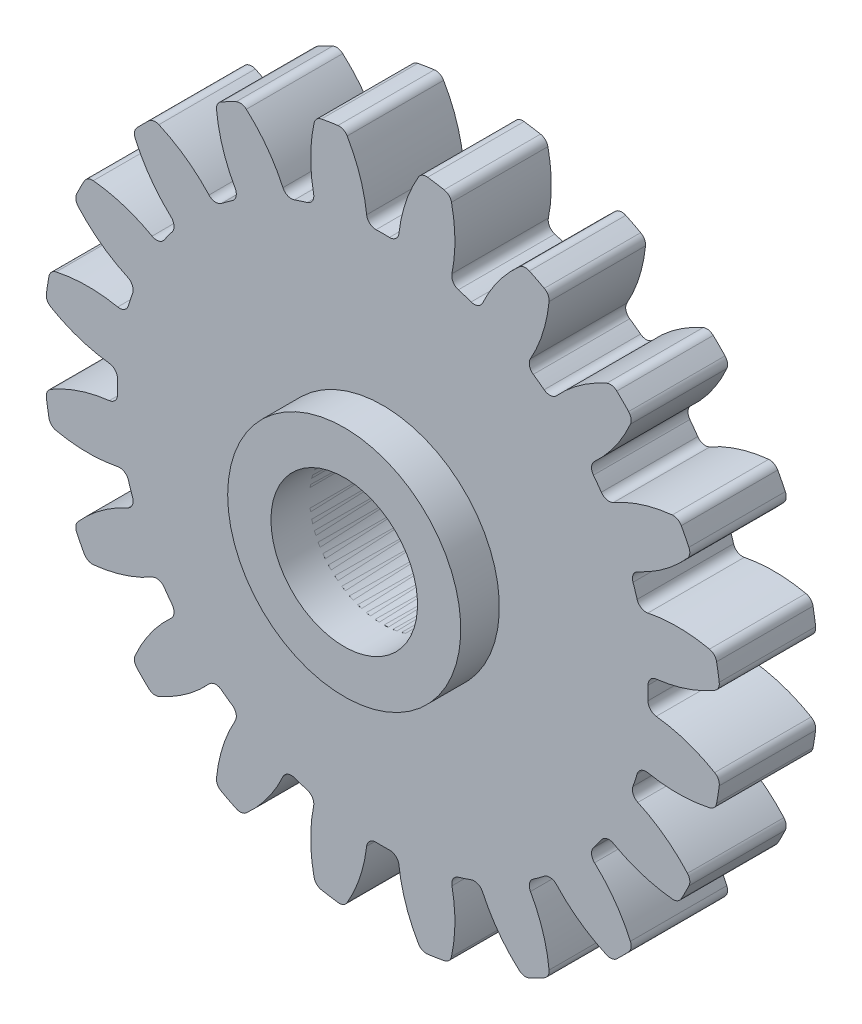
from build123d import *

# Parameters (mm, degrees)
SKETCH1_R                = 17.6
BOSS_EXTRUDE1_DEPTH      = 2.5
CUT_EXTRUDE1_DEPTH       = 26.387398449
FILLET1_R                = 0.48
CIRPATTERN1_COUNT        = 20
FILLET1_OF_CIRPATTERN1_R = 0.48
SKETCH23_R               = 3.25
CUT_EXTRUDE9_DEPTH       = 0.7
SKETCH24_R               = 4
CUT_EXTRUDE10_DEPTH      = 10
SKETCH25_R               = 4.603821227
BOSS_EXTRUDE2_DEPTH      = 5
SKETCH26_R               = 3.8
CUT_EXTRUDE11_DEPTH      = 10
BOSS_EXTRUDE3_DEPTH      = 2
BOSS_EXTRUDE3_DEPTH_BACK = 7
SKETCH27_R               = 6.044309444
SKETCH27_R_2             = 3.8


with BuildPart() as part:
    # Sketch1 → Boss-Extrude1 (new, symmetric)
    with BuildSketch(Plane.XY):
        Circle(SKETCH1_R)
    extrude(amount=BOSS_EXTRUDE1_DEPTH, both=True)

    # Sketch3 → Cut-Extrude1 (cut, symmetric)
    with BuildSketch(Plane.XY.offset(2.5)):
        with BuildLine():
            ThreePointArc((-2.700950464, 18.402849415), (-1.362234672, 16.227807184), (-0.798364242, 13.736819666))
            ThreePointArc((-0.798364242, 13.736819666), (0, 13.76), (0.798364242, 13.736819666))
            ThreePointArc((0.798364242, 13.736819666), (1.362234672, 16.227807184), (2.700950464, 18.402849415))
            ThreePointArc((2.700950464, 18.402849415), (0, 18.6), (-2.700950464, 18.402849415))
        make_face()
    cut_extrude1 = extrude(amount=CUT_EXTRUDE1_DEPTH, both=True, mode=Mode.SUBTRACT)

    # Fillet1
    fillet1_edges = [part.edges().sort_by_distance(p)[0] for p in [
        (-2.013394308, 17.484457194, 0),
        (-0.798364242, 13.736819666, 0),
        (0.798364242, 13.736819666, 0),
        (2.013394308, 17.484457194, 0),
    ]]
    fillet(fillet1_edges, radius=FILLET1_R)

    # CirPattern1: Cut-Extrude1 ×20 about axis
    cirpattern1_axis = Axis((0, 0, 0), (0, 0, 1))
    for i in range(1, CIRPATTERN1_COUNT):
        add(cut_extrude1.rotate(cirpattern1_axis, i * 360 / CIRPATTERN1_COUNT), mode=Mode.SUBTRACT)

    # Fillet1 of CirPattern1
    fillet1_of_cirpattern1_edges = [part.edges().sort_by_distance(p)[0] for p in [
        (-7.317846187, 16.00653389, 0),
        (-5.004200241, 12.817783738, 0),
        (-3.48562121, 13.311199975, 0),
        (-3.488142633, 17.250880006, 0),
        (-11.905976295, 12.961779526, 0),
        (-8.720190253, 10.644053831, 0),
        (-7.428409773, 11.582587286, 0),
        (-8.648235871, 15.328666489, 0),
        (-15.328666489, 8.648235871, 0),
        (-11.582587286, 7.428409773, 0),
        (-10.644053831, 8.720190253, 0),
        (-12.961779526, 11.905976295, 0),
        (-17.250880006, 3.488142633, 0),
        (-13.311199975, 3.48562121, 0),
        (-12.817783738, 5.004200241, 0),
        (-16.00653389, 7.317846187, 0),
        (-17.484457194, -2.013394308, 0),
        (-13.736819666, -0.798364242, 0),
        (-13.736819666, 0.798364242, 0),
        (-17.484457194, 2.013394308, 0),
        (-16.00653389, -7.317846187, 0),
        (-12.817783738, -5.004200241, 0),
        (-13.311199975, -3.48562121, 0),
        (-17.250880006, -3.488142633, 0),
        (-12.961779526, -11.905976295, 0),
        (-10.644053831, -8.720190253, 0),
        (-11.582587286, -7.428409773, 0),
        (-15.328666489, -8.648235871, 0),
        (-8.648235871, -15.328666489, 0),
        (-7.428409773, -11.582587286, 0),
        (-8.720190253, -10.644053831, 0),
        (-11.905976295, -12.961779526, 0),
        (-3.488142633, -17.250880006, 0),
        (-3.48562121, -13.311199975, 0),
        (-5.004200241, -12.817783738, 0),
        (-7.317846187, -16.00653389, 0),
        (2.013394308, -17.484457194, 0),
        (0.798364242, -13.736819666, 0),
        (-0.798364242, -13.736819666, 0),
        (-2.013394308, -17.484457194, 0),
        (7.317846187, -16.00653389, 0),
        (5.004200241, -12.817783738, 0),
        (3.48562121, -13.311199975, 0),
        (3.488142633, -17.250880006, 0),
        (11.905976295, -12.961779526, 0),
        (8.720190253, -10.644053831, 0),
        (7.428409773, -11.582587286, 0),
        (8.648235871, -15.328666489, 0),
        (15.328666489, -8.648235871, 0),
        (11.582587286, -7.428409773, 0),
        (10.644053831, -8.720190253, 0),
        (12.961779526, -11.905976295, 0),
        (17.250880006, -3.488142633, 0),
        (13.311199975, -3.48562121, 0),
        (12.817783738, -5.004200241, 0),
        (16.00653389, -7.317846187, 0),
        (17.484457194, 2.013394308, 0),
        (13.736819666, 0.798364242, 0),
        (13.736819666, -0.798364242, 0),
        (17.484457194, -2.013394308, 0),
        (16.00653389, 7.317846187, 0),
        (12.817783738, 5.004200241, 0),
        (13.311199975, 3.48562121, 0),
        (17.250880006, 3.488142633, 0),
        (12.961779526, 11.905976295, 0),
        (10.644053831, 8.720190253, 0),
        (11.582587286, 7.428409773, 0),
        (15.328666489, 8.648235871, 0),
        (8.648235871, 15.328666489, 0),
        (7.428409773, 11.582587286, 0),
        (8.720190253, 10.644053831, 0),
        (11.905976295, 12.961779526, 0),
        (3.488142633, 17.250880006, 0),
        (3.48562121, 13.311199975, 0),
        (5.004200241, 12.817783738, 0),
        (7.317846187, 16.00653389, 0),
    ]]
    fillet(fillet1_of_cirpattern1_edges, radius=FILLET1_OF_CIRPATTERN1_R)

    # Sketch23 → Cut-Extrude9 (cut)
    with BuildSketch(Plane(origin=(0, 0, -2.5), x_dir=(-1, 0, 0), z_dir=(0, 0, -1))):
        Circle(SKETCH23_R)
    extrude(amount=-CUT_EXTRUDE9_DEPTH, mode=Mode.SUBTRACT)

    # Sketch24 → Cut-Extrude10 (cut)
    with BuildSketch(Plane.XY.offset(2.5)):
        Circle(SKETCH24_R)
    extrude(amount=-CUT_EXTRUDE10_DEPTH, mode=Mode.SUBTRACT)

    # Sketch25 → Boss-Extrude2 (add, through all)
    with BuildSketch(Plane.XY.offset(2.5)):
        Circle(SKETCH25_R)
    extrude(amount=-BOSS_EXTRUDE2_DEPTH)

    # Sketch26 → Cut-Extrude11 (cut)
    with BuildSketch(Plane(origin=(0, 0, -2.5), x_dir=(-1, 0, 0), z_dir=(0, 0, -1))):
        Circle(SKETCH26_R)
    extrude(amount=-CUT_EXTRUDE11_DEPTH, mode=Mode.SUBTRACT)


with BuildPart() as body_2:
    # Sketch27 → Boss-Extrude3 (new, two sides: drawn at the far end of the back side and taken through both)
    with BuildSketch(Plane(origin=(0, 0, -2.5), x_dir=(-1, 0, 0), z_dir=(0, 0, -1)).offset(-BOSS_EXTRUDE3_DEPTH_BACK)):
        Circle(SKETCH27_R)
        Circle(SKETCH27_R_2, mode=Mode.SUBTRACT)
    extrude(amount=BOSS_EXTRUDE3_DEPTH + BOSS_EXTRUDE3_DEPTH_BACK)


solid = Compound([part.part, body_2.part])
